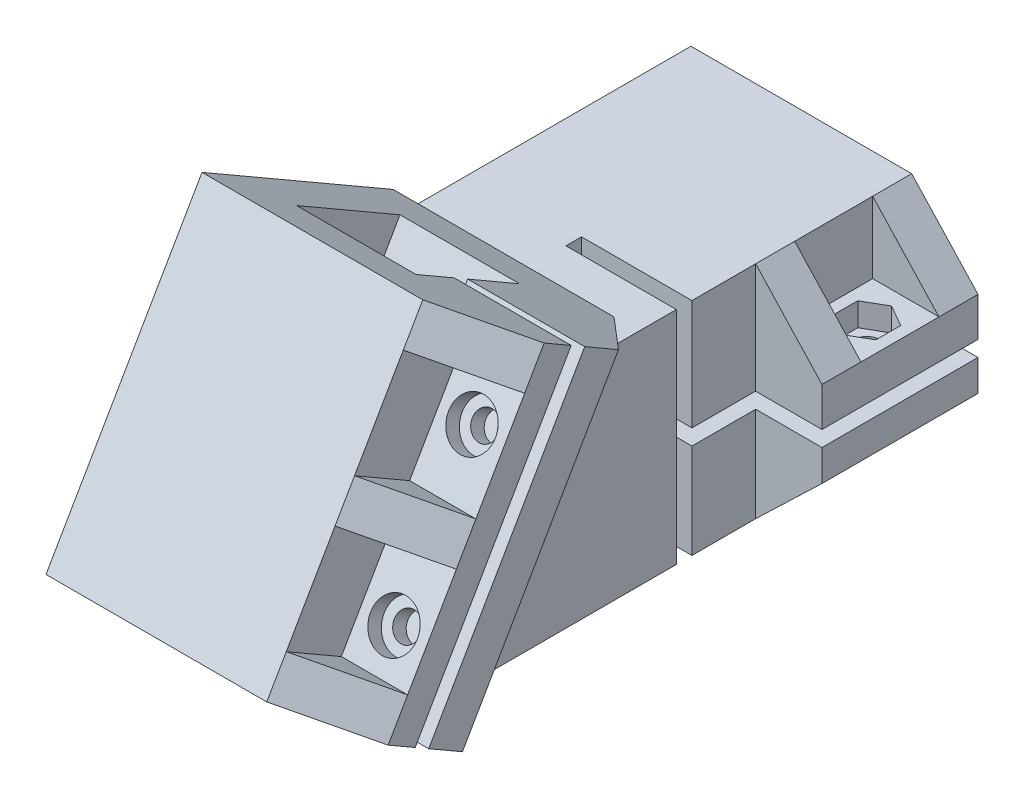
from build123d import *

# Parameters (mm, degrees)
ESQUISSE1_W                = 28.3
ESQUISSE1_H                = 28.3
ESQUISSE1_W_2              = 20.3
ESQUISSE1_H_2              = 20.3
ESQUISSE1_W_3              = 4
ESQUISSE1_H_3              = 2
BOSS_EXTRU_1_DEPTH         = 20
BOSS_EXTRU_7_DEPTH         = 20
ESQUISSE2_W                = 8.5
ESQUISSE2_H                = 20
ESQUISSE2_R                = 1.7
BOSS_EXTRU_2_DEPTH         = 2
ESQUISSE2_3_W              = 8.5
ESQUISSE2_3_H              = 20
BOSS_EXTRU_3_DEPTH         = 3
ESQUISSE3_W                = 8.5
ESQUISSE3_H                = 20
ESQUISSE3_R                = 1.7
BOSS_EXTRU_4_DEPTH         = 2
ESQUISSE5_W                = 8.5
ESQUISSE5_H                = 20
ESQUISSE5_R                = 3
BOSS_EXTRU_5_DEPTH         = 2
BOSS_EXTRU_6_DEPTH         = 20
BOSS_EXTRU_6_DEPTH_BACK    = 20
ESQUISSE6_W                = 28.3
ESQUISSE6_H                = 28.3
ESQUISSE6_W_2              = 15.3
ESQUISSE6_H_2              = 15.3
BOSS_EXTRU_12_REACH        = 59.663
ESQUISSE20_W               = 28.3
ESQUISSE20_H               = 28.3
ENL_V_MAT_EXTRU_1_REACH    = 81.469
ESQUISSE7_W                = 6.5
ESQUISSE7_H                = 2
ENL_V_MAT_EXTRU_2_REACH    = 82.765
ESQUISSE8_W                = 14.15
ESQUISSE8_H                = 2
ESQUISSE9_W                = 8.5
ESQUISSE9_H                = 40
BOSS_EXTRU_8_DEPTH         = 5
ESQUISSE9_4_R              = 1.7
BOSS_EXTRU_9_DEPTH         = 2
ESQUISSE10_W               = 8.5
ESQUISSE10_H               = 40
ESQUISSE10_R               = 1.7
BOSS_EXTRU_10_DEPTH        = 2
ESQUISSE11_W               = 8.5
ESQUISSE11_H               = 40
ESQUISSE11_R               = 3
BOSS_EXTRU_11_DEPTH        = 2
NERVURE4_REACH             = 81.469
ESQUISSE14_WALL_W          = 172.71321229
ESQUISSE14_WALL_H          = 5
NERVURE10_REACH            = 81.469
ESQUISSE16_WALL_W          = 173.426178518
ESQUISSE16_WALL_H          = 5
R_P_TITION_LIN_AIRE1_COUNT = 3
R_P_TITION_LIN_AIRE1_PITCH = 17.5
NERVURE11_REACH            = 93.316
ESQUISSE17_WALL_W          = 197.121376998
ESQUISSE17_WALL_H          = 5
NERVURE17_REACH            = 75.701
ESQUISSE19_WALL_W          = 161.177827304
ESQUISSE19_WALL_H          = 5
R_P_TITION_LIN_AIRE2_COUNT = 2
R_P_TITION_LIN_AIRE2_PITCH = 15
R_P_TITION_LIN_AIRE3_COUNT = 2
R_P_TITION_LIN_AIRE3_PITCH = 15
ENL_V_MAT_EXTRU_3_REACH    = 75.701
ESQUISSE21_W               = 4
ESQUISSE21_H               = 2.012776607


with BuildPart() as part:
    # Esquisse1 → Boss.-Extru.1 (new body)
    # profile 1 of 2: a face of its own
    with BuildSketch(Plane.XY):
        Rectangle(ESQUISSE1_W, ESQUISSE1_H)
        Rectangle(ESQUISSE1_W_2, ESQUISSE1_H_2, mode=Mode.SUBTRACT)
    # profile 2 of 2: a face of its own
    with BuildSketch(Plane.XY):
        with Locations((12.15, -1)):
            Rectangle(ESQUISSE1_W_3, ESQUISSE1_H_3)
    extrude(amount=BOSS_EXTRU_1_DEPTH)

    # Esquisse1<3> → Boss.-Extru.7 (add)
    with BuildSketch(Plane.XY):
        Polygon((14.15, 14.15), (-14.15, 14.15), (-14.15, -14.15), (14.15, -14.15), (14.15, -2), (10.15, -2), (10.15, -10.15), (-10.15, -10.15), (-10.15, 10.15), (10.15, 10.15), (10.15, 0), (14.15, 0), align=None)
    extrude(amount=-BOSS_EXTRU_7_DEPTH)

    # Esquisse2 → Boss.-Extru.2 (add)
    with BuildSketch(Plane(origin=(0, 2, 0), x_dir=(-1, 0, 0), z_dir=(0, -1, 0))):
        with Locations((-18.4, 10)):
            Rectangle(ESQUISSE2_W, ESQUISSE2_H)
        with Locations(Location((-18.4, 10, 0), (0, 0, 180))):
            Circle(ESQUISSE2_R, mode=Mode.SUBTRACT)
    extrude(amount=BOSS_EXTRU_2_DEPTH)

    # Esquisse2<3> → Boss.-Extru.3 (add)
    with BuildSketch(Plane(origin=(0, 2, 0), x_dir=(-1, 0, 0), z_dir=(0, -1, 0))):
        with Locations((-18.4, 10)):
            Rectangle(ESQUISSE2_3_W, ESQUISSE2_3_H)
        Polygon((-15.65, 11.58771324), (-15.65, 8.41228676), (-18.4, 6.824573519), (-21.15, 8.41228676), (-21.15, 11.58771324), (-18.4, 13.175426481), align=None, mode=Mode.SUBTRACT)
    extrude(amount=-BOSS_EXTRU_3_DEPTH)

    # Esquisse3 → Boss.-Extru.4 (add)
    with BuildSketch(Plane(origin=(0, -2, 0), x_dir=(1, 0, 0), z_dir=(0, 1, 0))):
        with Locations((18.4, 10)):
            Rectangle(ESQUISSE3_W, ESQUISSE3_H)
        with Locations((18.4, 10)):
            Circle(ESQUISSE3_R, mode=Mode.SUBTRACT)
    extrude(amount=-BOSS_EXTRU_4_DEPTH)

    # Esquisse5 → Boss.-Extru.5 (add)
    with BuildSketch(Plane.XZ.offset(4)):
        with Locations((18.4, -10)):
            Rectangle(ESQUISSE5_W, ESQUISSE5_H)
        with Locations((18.4, -10)):
            Circle(ESQUISSE5_R, mode=Mode.SUBTRACT)
    extrude(amount=BOSS_EXTRU_5_DEPTH)


with BuildPart() as body_2:
    # Esquisse6 → Boss.-Extru.6 (new, two sides: drawn at the far end of the back side and taken through both)
    with BuildSketch(Plane(origin=(0, -11.88296393, 7.558102729), x_dir=(-1, 0, 0), z_dir=(0, -0.8660254037844382, 0.5000000000000011)).offset(-BOSS_EXTRU_6_DEPTH_BACK)):
        with Locations((0, -37.941481073)):
            Rectangle(ESQUISSE6_W, ESQUISSE6_H)
        with Locations((0, -37.941481073)):
            Rectangle(ESQUISSE6_W_2, ESQUISSE6_H_2, mode=Mode.SUBTRACT)
    extrude(amount=BOSS_EXTRU_6_DEPTH + BOSS_EXTRU_6_DEPTH_BACK)

    # Esquisse20 → Boss.-Extru.12 (add, up to next)
    with BuildSketch(Plane.XY.offset(20), mode=Mode.PRIVATE) as boss_extru_12_sk1:
        Rectangle(ESQUISSE20_W, ESQUISSE20_H)
    boss_extru_12_tool1 = extrude(boss_extru_12_sk1.sketch, amount=BOSS_EXTRU_12_REACH, mode=Mode.PRIVATE) - body_2.part

    add(part.part)  # Boss.-Extru.12 merges part
    add(boss_extru_12_tool1.solids().sort_by_distance((0, 0, 20))[0])

    # Esquisse7 → Enlèv. mat.-Extru.1 (cut, up to next)
    with BuildSketch(Plane(origin=(0, -29.505485507, 17.035), x_dir=(1, 0, 0), z_dir=(0, -0.866025403784438, 0.5000000000000011)), mode=Mode.PRIVATE) as enl_v_mat_extru_1_sk1:
        with Locations((10.9, 39.545508076)):
            Rectangle(ESQUISSE7_W, ESQUISSE7_H)
    enl_v_mat_extru_1_tool1 = extrude(enl_v_mat_extru_1_sk1.sketch, amount=-ENL_V_MAT_EXTRU_1_REACH, mode=Mode.PRIVATE) & body_2.part
    add(enl_v_mat_extru_1_tool1.solids().sort_by_distance((10.9, -9.732731, 51.282415))[0], mode=Mode.SUBTRACT)

    # Esquisse8 → Enlèv. mat.-Extru.2 (cut, up to next)
    with BuildSketch(Plane.XZ.offset(14.15), mode=Mode.PRIVATE) as enl_v_mat_extru_2_sk1:
        with Locations((7.075, 9.169506309)):
            Rectangle(ESQUISSE8_W, ESQUISSE8_H)
    enl_v_mat_extru_2_tool1 = extrude(enl_v_mat_extru_2_sk1.sketch, amount=-ENL_V_MAT_EXTRU_2_REACH, mode=Mode.PRIVATE) & body_2.part
    add(enl_v_mat_extru_2_tool1.solids().sort_by_distance((7.075, -14.15, 9.169506))[0], mode=Mode.SUBTRACT)

    # Esquisse9 → Boss.-Extru.8 (add)
    with BuildSketch(Plane(origin=(0, 19.272754038, 33.381389195), x_dir=(1, 0, 0), z_dir=(0, 0.5000000000000011, 0.866025403784438))):
        with Locations((18.4, -14.07)):
            Rectangle(ESQUISSE9_W, ESQUISSE9_H)
        Polygon((18.4, -7.245426481), (21.15, -5.65771324), (21.15, -2.48228676), (18.4, -0.894573519), (15.65, -2.48228676), (15.65, -5.65771324), align=None, mode=Mode.SUBTRACT)
        Polygon((18.4, -20.894573519), (21.15, -22.48228676), (21.15, -25.65771324), (18.4, -27.245426481), (15.65, -25.65771324), (15.65, -22.48228676), align=None, mode=Mode.SUBTRACT)
    extrude(amount=-BOSS_EXTRU_8_DEPTH)

    # Esquisse9<4> → Boss.-Extru.9 (add)
    # profile 1 of 2: a face of its own
    with BuildSketch(Plane(origin=(0, 19.272754038, 33.381389195), x_dir=(1, 0, 0), z_dir=(0, 0.5000000000000011, 0.866025403784438))):
        Polygon((15.65, -5.65771324), (18.4, -7.245426481), (21.15, -5.65771324), (21.15, -2.48228676), (18.4, -0.894573519), (15.65, -2.48228676), align=None)
        with Locations(Location((18.4, -4.07, 0), (0, 0, 270))):
            Circle(ESQUISSE9_4_R, mode=Mode.SUBTRACT)
    # profile 2 of 2: a face of its own
    with BuildSketch(Plane(origin=(0, 19.272754038, 33.381389195), x_dir=(1, 0, 0), z_dir=(0, 0.5000000000000011, 0.866025403784438))):
        Polygon((21.15, -22.48228676), (21.15, -25.65771324), (18.4, -27.245426481), (15.65, -25.65771324), (15.65, -22.48228676), (18.4, -20.894573519), align=None)
        with Locations(Location((18.4, -24.07, 0), (0, 0, 270))):
            Circle(ESQUISSE9_4_R, mode=Mode.SUBTRACT)
    extrude(amount=-BOSS_EXTRU_9_DEPTH)

    # Esquisse10 → Boss.-Extru.10 (add)
    with BuildSketch(Plane(origin=(0, 20.272754038, 35.113440003), x_dir=(-1, 0, 0), z_dir=(0, -0.5000000000000011, -0.866025403784438))):
        with Locations((-18.4, -14.07)):
            Rectangle(ESQUISSE10_W, ESQUISSE10_H)
        with Locations(Location((-18.4, -24.07, 0), (0, 0, 270))):
            Circle(ESQUISSE10_R, mode=Mode.SUBTRACT)
        with Locations(Location((-18.4, -4.07, 0), (0, 0, 270))):
            Circle(ESQUISSE10_R, mode=Mode.SUBTRACT)
    extrude(amount=-BOSS_EXTRU_10_DEPTH)

    # Esquisse11 → Boss.-Extru.11 (add)
    with BuildSketch(Plane(origin=(0, 21.272754038, 36.84549081), x_dir=(1, 0, 0), z_dir=(0, 0.5000000000000011, 0.866025403784438))):
        with Locations((18.4, -14.07)):
            Rectangle(ESQUISSE11_W, ESQUISSE11_H)
        with Locations(Location((18.4, -4.07, 0), (0, 0, 270))):
            Circle(ESQUISSE11_R, mode=Mode.SUBTRACT)
        with Locations(Location((18.4, -24.07, 0), (0, 0, 270))):
            Circle(ESQUISSE11_R, mode=Mode.SUBTRACT)
    extrude(amount=BOSS_EXTRU_11_DEPTH)

    # Esquisse14 wall → Nervure4 (add, up to next)
    with BuildSketch(Plane(origin=(18.4, -5.195231469, 59.141595139), x_dir=(0.721811427089, -0.346044890046, -0.599367331272), z_dir=(0.692089780103, 0.360905713545, 0.625107032601)), mode=Mode.PRIVATE) as nervure4_sk1:
        with Locations((0, 2.5)):
            Rectangle(ESQUISSE14_WALL_W, ESQUISSE14_WALL_H)
    nervure4_tool1 = extrude(nervure4_sk1.sketch, amount=-NERVURE4_REACH, mode=Mode.PRIVATE) - body_2.part
    nervure4 = nervure4_tool1.solids().sort_by_distance((18.4, -5.195231469, 59.141595139))[0]
    add(nervure4)

    # Esquisse16 wall → Nervure10 (add, up to next)
    with BuildSketch(Plane(origin=(18.4, -15.020231469, 42.124195954), x_dir=(-0.680604645529, -0.366325441564, -0.634494276844), z_dir=(0.732650883085, -0.340302322764, -0.589420912962)), mode=Mode.PRIVATE) as nervure10_sk1:
        with Locations((0, 2.5)):
            Rectangle(ESQUISSE16_WALL_W, ESQUISSE16_WALL_H)
    nervure10_tool1 = extrude(nervure10_sk1.sketch, amount=-NERVURE10_REACH, mode=Mode.PRIVATE) - body_2.part
    nervure10 = nervure10_tool1.solids().sort_by_distance((18.4, -15.020231469, 42.124195954))[0]
    add(nervure10)

    # Répétition linéaire1: Nervure4, Nervure10 ×3
    with Locations(*[Vector(0, 0.8660254037844382, -0.500000000000001) * (i * R_P_TITION_LIN_AIRE1_PITCH) for i in range(1, R_P_TITION_LIN_AIRE1_COUNT)]):
        add(nervure4)
        add(nervure10)

    # Esquisse17 wall → Nervure11 (add, up to next)
    with BuildSketch(Plane(origin=(18.4, 9.575, -20), x_dir=(-0.680604645507, 0.732650883105, 0), z_dir=(0.732650883105, 0.680604645507, 0)), mode=Mode.PRIVATE) as nervure11_sk1:
        with Locations((0, 2.5)):
            Rectangle(ESQUISSE17_WALL_W, ESQUISSE17_WALL_H)
    nervure11_tool1 = extrude(nervure11_sk1.sketch, amount=-NERVURE11_REACH, mode=Mode.PRIVATE) - body_2.part
    nervure11 = nervure11_tool1.solids().sort_by_distance((18.4, 9.575, -20))[0]
    add(nervure11)

    # Esquisse19 wall → Nervure17 (add, up to next)
    with BuildSketch(Plane(origin=(18.4, -10.075, 0), x_dir=(-0.721811427095, -0.692089780097, 0), z_dir=(0.692089780097, -0.721811427095, 0)), mode=Mode.PRIVATE) as nervure17_sk1:
        with Locations((0, 2.5)):
            Rectangle(ESQUISSE19_WALL_W, ESQUISSE19_WALL_H)
    nervure17_tool1 = extrude(nervure17_sk1.sketch, amount=-NERVURE17_REACH, mode=Mode.PRIVATE) - body_2.part
    nervure17 = nervure17_tool1.solids().sort_by_distance((18.4, -10.075, 0))[0]
    add(nervure17)

    # Répétition linéaire2: Nervure17 ×2
    with Locations(*[(0, 0, -i * R_P_TITION_LIN_AIRE2_PITCH) for i in range(1, R_P_TITION_LIN_AIRE2_COUNT)]):
        add(nervure17)

    # Répétition linéaire3: Nervure11 ×2
    with Locations(*[(0, 0, i * R_P_TITION_LIN_AIRE3_PITCH) for i in range(1, R_P_TITION_LIN_AIRE3_COUNT)]):
        add(nervure11)

    # Esquisse21 → Enlèv. mat.-Extru.3 (cut, up to next)
    with BuildSketch(Plane(origin=(0, 0, 0), x_dir=(-1, 0, 0), z_dir=(0, 0, -1)), mode=Mode.PRIVATE) as enl_v_mat_extru_3_sk1:
        with Locations((-12.15, -0.993611697)):
            Rectangle(ESQUISSE21_W, ESQUISSE21_H)
    enl_v_mat_extru_3_tool1 = extrude(enl_v_mat_extru_3_sk1.sketch, amount=-ENL_V_MAT_EXTRU_3_REACH, mode=Mode.PRIVATE) & body_2.part
    add(enl_v_mat_extru_3_tool1.solids().sort_by_distance((12.15, -0.993612, 0))[0], mode=Mode.SUBTRACT)


solid = body_2.part
